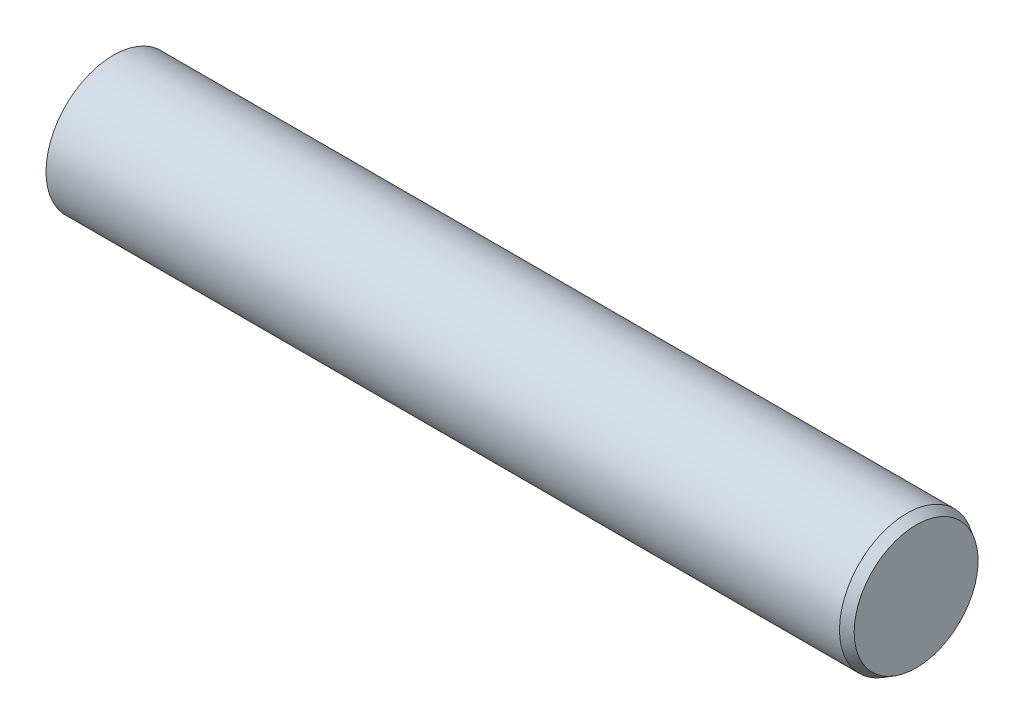
from build123d import *
from OCP.BRepFilletAPI import BRepFilletAPI_MakeChamfer

# Parameters (mm, degrees)
SKETCH1_W      = 30
SKETCH1_H      = 2.5
CHAMFER1_SIZE  = 0.2
CHAMFER1_SIZE2 = 0.346410162


with BuildPart() as part:
    # Sketch1 → Revolve1 (revolve)
    with BuildSketch(Plane.XY, mode=Mode.PRIVATE) as revolve1_sk:
        with Locations((15, 1.25)):
            Rectangle(SKETCH1_W, SKETCH1_H)
    revolve(revolve1_sk.sketch.rotate(Axis((0, 0, 0), (1, 0, 0)), 90), axis=Axis((0, 0, 0), (1, 0, 0)))

    # Chamfer1: one chamfer whose edges measure the first distance from different faces: ONE call of the kernel's chamfer builder (chamfer() names one face for all edges)
    chamfer1_edges_1 = [part.edges().sort_by_distance(p)[0] for p in [
        (30, 0, -2.5),
    ]]
    chamfer1_side_1 = [part.faces().sort_by_distance(p)[0] for p in [
        (30, 0, 0),
    ]]
    chamfer1_edges_2 = [part.edges().sort_by_distance(p)[0] for p in [
        (0, 0, -2.5),
    ]]
    chamfer1_side_2 = [part.faces().sort_by_distance(p)[0] for p in [
        (15, 0, -2.5),
    ]]
    chamfer1 = BRepFilletAPI_MakeChamfer(part.part.solid().wrapped)
    for e in chamfer1_edges_1:
        chamfer1.Add(CHAMFER1_SIZE, CHAMFER1_SIZE2, e.wrapped, chamfer1_side_1[0].wrapped)  # the first distance lies on this face
    for e in chamfer1_edges_2:
        chamfer1.Add(CHAMFER1_SIZE, CHAMFER1_SIZE2, e.wrapped, chamfer1_side_2[0].wrapped)  # the first distance lies on this face
    add(Compound.cast(chamfer1.Shape()), mode=Mode.REPLACE)


solid = part.part
